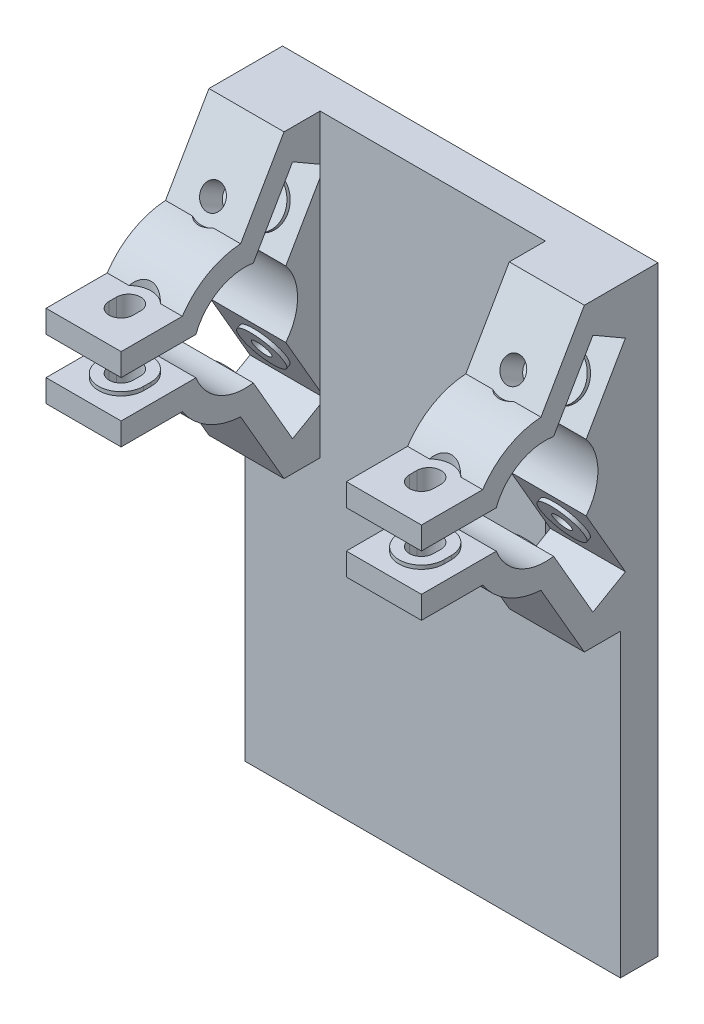
from build123d import *

# Parameters (mm, degrees)
SKETCH_1_W               = 5
SKETCH_1_H               = 80
EXTRUDE_1_DEPTH          = 50
EXTRUDE_2_DEPTH          = 10
SKETCH_6_W               = 10
SKETCH_6_H               = 3.813086718
CUT_EXTRUDE_10_DEPTH     = 1
SKETCH_2_R               = 3
EXTRUDE_3_DEPTH          = 0.5
EXTRUDE_START            = 4.5
SKETCH_2_3_R             = 3
EXTRUDE_4_DEPTH          = 0.5
CUT_EXTRUDE_START        = 0.5
SKETCH_2_4_R             = 1.25
CUT_EXTRUDE_1_DEPTH      = 10
CUT_EXTRUDE_START_2      = 8
SKETCH_2_5_R             = 3
CUT_EXTRUDE_4_DEPTH      = 1
CUT_EXTRUDE_START_3      = 4.5
SKETCH_2_6_R             = 1.6
CUT_EXTRUDE_5_DEPTH      = 3.5
EXTRUDE_START_2          = -3
EXTRUDE_5_DEPTH          = 0.5
EXTRUDE_START_3          = -7.5
EXTRUDE_6_DEPTH          = 0.5
CUT_EXTRUDE_START_4      = 2
CUT_EXTRUDE_6_DEPTH      = 2
CUT_EXTRUDE_7_DEPTH      = 11
CUT_EXTRUDE_8_DEPTH      = 2
MIRROR_6_COPY_1_SKETCH_W = 10
MIRROR_6_COPY_1_SKETCH_H = 3.813086718
MIRROR_6_COPY_1_DEPTH    = 1
MIRROR_6_COPY_2_SKETCH_R = 3
MIRROR_6_COPY_2_DEPTH    = 0.5
MIRROR_START             = 4.5
MIRROR_6_COPY_3_SKETCH_R = 3
MIRROR_6_COPY_3_DEPTH    = 0.5
MIRROR_START_2           = 0.5
MIRROR_6_COPY_4_SKETCH_R = 1.25
MIRROR_6_COPY_4_DEPTH    = 10
MIRROR_START_3           = 8
MIRROR_6_COPY_5_SKETCH_R = 3
MIRROR_6_COPY_5_DEPTH    = 1
MIRROR_6_COPY_6_SKETCH_R = 1.6
MIRROR_6_COPY_6_DEPTH    = 3.5


with BuildPart() as part:
    # Эскиз1 → Бобышка-Вытянуть1 (new body)
    with BuildSketch(Plane(origin=(0, 0, 0), x_dir=(0, 0, -1), z_dir=(1, 0, 0))):
        with Locations((2.5, 0)):
            Rectangle(SKETCH_1_W, SKETCH_1_H)
    extrude(amount=EXTRUDE_1_DEPTH)

    # Эскиз1<3> → Бобышка-Вытянуть2 (add)
    with BuildSketch(Plane(origin=(0, 0, 0), x_dir=(0, 0, -1), z_dir=(1, 0, 0))):
        with BuildLine():
            Line((-4.803847577, 0), (0, 0))
            Line((0, 0), (0, 6.143593539))
            Line((0, 6.143593539), (-3.665063509, 4.027568136))
            Line((-3.665063509, 4.027568136), (-8.895889302, 13.087624174))
            ThreePointArc((-8.895889302, 13.087624174), (-13.5, 13.937822174), (-16.538348415, 17.5))
            Line((-16.538348415, 17.5), (-26.5, 17.5))
            Line((-26.5, 17.5), (-26.5, 14.5))
            Line((-26.5, 14.5), (-18.351646544, 14.5))
            ThreePointArc((-18.351646544, 14.5), (-15, 11.339745962), (-10.587316449, 10.017261929))
            Line((-10.587316449, 10.017261929), (-4.803847577, 0))
        make_face()
        with BuildLine():
            Line((-4.565762283, 15.587624174), (0, 7.679491924))
            Line((0, 7.679491924), (0, 32.320508076))
            Line((0, 32.320508076), (-4.565762283, 24.412375826))
            ThreePointArc((-4.565762283, 24.412375826), (-3, 20), (-4.565762283, 15.587624174))
        make_face()
        with BuildLine():
            Line((0, 33.856406461), (0, 40))
            Line((0, 40), (-4.803847577, 40))
            Line((-4.803847577, 40), (-10.587316449, 29.982738071))
            ThreePointArc((-10.587316449, 29.982738071), (-15, 28.660254038), (-18.351646544, 25.5))
            Line((-18.351646544, 25.5), (-26.5, 25.5))
            Line((-26.5, 25.5), (-26.5, 22.5))
            Line((-26.5, 22.5), (-16.538348415, 22.5))
            ThreePointArc((-16.538348415, 22.5), (-13.5, 26.062177826), (-8.895889302, 26.912375826))
            Line((-8.895889302, 26.912375826), (-3.665063509, 35.972431864))
            Line((-3.665063509, 35.972431864), (0, 33.856406461))
        make_face()
    extrude_2 = extrude(amount=EXTRUDE_2_DEPTH)

    # Эскиз6 → Вырез-Вытянуть10 (cut)
    with BuildSketch(Plane(origin=(0, 8.080127019, 13.995190528), x_dir=(1, 0, 0), z_dir=(0, 0.4999999999999973, 0.8660254037844403))):
        with Locations((5, 27.413964717)):
            Rectangle(SKETCH_6_W, SKETCH_6_H)
    cut_extrude_10 = extrude(amount=CUT_EXTRUDE_10_DEPTH, mode=Mode.SUBTRACT)

    # Эскиз2 → Бобышка-Вытянуть3 (add)
    with BuildSketch(Plane(origin=(0, 8.080127019, 13.995190528), x_dir=(1, 0, 0), z_dir=(0, 0.4999999999999973, 0.8660254037844403))):
        with Locations((5, 23.320508076)):
            Circle(SKETCH_2_R)
    extrude_3 = extrude(amount=EXTRUDE_3_DEPTH)

    # Эскиз2<3> → Бобышка-Вытянуть4 (add)
    with BuildSketch(Plane(origin=(0, 8.080127019, 13.995190528), x_dir=(1, 0, 0), z_dir=(0, 0.4999999999999973, 0.8660254037844403)).offset(EXTRUDE_START)):
        with Locations((5, 23.320508076)):
            Circle(SKETCH_2_3_R)
    extrude_4 = extrude(amount=EXTRUDE_4_DEPTH)

    # Эскиз2<4> → Вырез-Вытянуть1 (cut)
    with BuildSketch(Plane(origin=(0, 8.080127019, 13.995190528), x_dir=(1, 0, 0), z_dir=(0, 0.4999999999999973, 0.8660254037844403)).offset(CUT_EXTRUDE_START)):
        with Locations((5, 23.320508076)):
            Circle(SKETCH_2_4_R)
    cut_extrude_1 = extrude(amount=-CUT_EXTRUDE_1_DEPTH, mode=Mode.SUBTRACT)

    # Эскиз2<5> → Вырез-Вытянуть4 (cut)
    with BuildSketch(Plane(origin=(0, 8.080127019, 13.995190528), x_dir=(1, 0, 0), z_dir=(0, 0.4999999999999973, 0.8660254037844403)).offset(CUT_EXTRUDE_START_2)):
        with Locations((5, 23.320508076)):
            Circle(SKETCH_2_5_R)
    cut_extrude_4 = extrude(amount=CUT_EXTRUDE_4_DEPTH, mode=Mode.SUBTRACT)

    # Эскиз2<6> → Вырез-Вытянуть5 (cut)
    with BuildSketch(Plane(origin=(0, 8.080127019, 13.995190528), x_dir=(1, 0, 0), z_dir=(0, 0.4999999999999973, 0.8660254037844403)).offset(CUT_EXTRUDE_START_3)):
        with Locations((5, 23.320508076)):
            Circle(SKETCH_2_6_R)
    cut_extrude_5 = extrude(amount=CUT_EXTRUDE_5_DEPTH, mode=Mode.SUBTRACT)

    # Зеркальное отражение3: Вырез-Вытянуть10, Бобышка-Вытянуть3, Бобышка-Вытянуть4, Вырез-Вытянуть1, Вырез-Вытянуть4, Вырез-Вытянуть5 across plane
    add(cut_extrude_10.mirror(Plane(origin=(0, 20, 0), x_dir=(0, 0, 1), z_dir=(0, -1, 0))), mode=Mode.SUBTRACT)
    add(extrude_3.mirror(Plane(origin=(0, 20, 0), x_dir=(0, 0, 1), z_dir=(0, -1, 0))))
    add(extrude_4.mirror(Plane(origin=(0, 20, 0), x_dir=(0, 0, 1), z_dir=(0, -1, 0))))
    add(cut_extrude_1.mirror(Plane(origin=(0, 20, 0), x_dir=(0, 0, 1), z_dir=(0, -1, 0))), mode=Mode.SUBTRACT)
    add(cut_extrude_4.mirror(Plane(origin=(0, 20, 0), x_dir=(0, 0, 1), z_dir=(0, -1, 0))), mode=Mode.SUBTRACT)
    add(cut_extrude_5.mirror(Plane(origin=(0, 20, 0), x_dir=(0, 0, 1), z_dir=(0, -1, 0))), mode=Mode.SUBTRACT)

    # Эскиз3 → Бобышка-Вытянуть5 (add)
    with BuildSketch(Plane(origin=(0, 25.5, 0), x_dir=(1, 0, 0), z_dir=(0, 1, 0)).offset(EXTRUDE_START_2)):
        with BuildLine():
            Line((8, -20.5), (8, -21.5))
            ThreePointArc((8, -21.5), (5, -24.5), (2, -21.5))
            Line((2, -21.5), (2, -20.5))
            ThreePointArc((2, -20.5), (5, -17.5), (8, -20.5))
        make_face()
    extrude_5 = extrude(amount=-EXTRUDE_5_DEPTH)

    # Эскиз3<3> → Бобышка-Вытянуть6 (add)
    with BuildSketch(Plane(origin=(0, 25.5, 0), x_dir=(1, 0, 0), z_dir=(0, 1, 0)).offset(EXTRUDE_START_3)):
        with BuildLine():
            Line((8, -20.5), (8, -21.5))
            ThreePointArc((8, -21.5), (5, -24.5), (2, -21.5))
            Line((2, -21.5), (2, -20.5))
            ThreePointArc((2, -20.5), (5, -17.5), (8, -20.5))
        make_face()
    extrude_6 = extrude(amount=-EXTRUDE_6_DEPTH)

    # Эскиз3<4> → Вырез-Вытянуть6 (cut)
    with BuildSketch(Plane(origin=(0, 25.5, 0), x_dir=(1, 0, 0), z_dir=(0, 1, 0)).offset(CUT_EXTRUDE_START_4)):
        with BuildLine():
            Line((8, -20.5), (8, -21.5))
            ThreePointArc((8, -21.5), (5, -24.5), (2, -21.5))
            Line((2, -21.5), (2, -20.5))
            ThreePointArc((2, -20.5), (5, -17.5), (8, -20.5))
        make_face()
        with BuildLine():
            Line((6.6, -20.5), (6.6, -21.5))
            ThreePointArc((6.6, -21.5), (5, -23.1), (3.4, -21.5))
            Line((3.4, -21.5), (3.4, -20.5))
            ThreePointArc((3.4, -20.5), (5, -18.9), (6.6, -20.5))
        make_face(mode=Mode.SUBTRACT)
    cut_extrude_6 = extrude(amount=-CUT_EXTRUDE_6_DEPTH, mode=Mode.SUBTRACT)

    # Эскиз3<6> → Вырез-Вытянуть7 (cut)
    with BuildSketch(Plane(origin=(0, 25.5, 0), x_dir=(1, 0, 0), z_dir=(0, 1, 0))):
        with BuildLine():
            Line((6.6, -20.5), (6.6, -21.5))
            ThreePointArc((6.6, -21.5), (5, -23.1), (3.4, -21.5))
            Line((3.4, -21.5), (3.4, -20.5))
            ThreePointArc((3.4, -20.5), (5, -18.9), (6.6, -20.5))
        make_face()
    cut_extrude_7 = extrude(amount=-CUT_EXTRUDE_7_DEPTH, mode=Mode.SUBTRACT)

    # Эскиз4 → Вырез-Вытянуть8 (cut)
    with BuildSketch(Plane.XZ.offset(-14.5)):
        Polygon((5, 17.266838493), (7.8, 18.883419246), (7.8, 22.116580754), (5, 23.733161507), (2.2, 22.116580754), (2.2, 18.883419246), align=None)
    cut_extrude_8 = extrude(amount=CUT_EXTRUDE_8_DEPTH, mode=Mode.SUBTRACT)

    # Зеркальное отражение6: Бобышка-Вытянуть2, Вырез-Вытянуть10, Бобышка-Вытянуть3, Бобышка-Вытянуть4, Вырез-Вытянуть1, Вырез-Вытянуть4, Вырез-Вытянуть5, Бобышка-Вытянуть5, Бобышка-Вытянуть6, Вырез-Вытянуть6, Вырез-Вытянуть7, Вырез-Вытянуть8 across plane
    add(extrude_2.mirror(Plane(origin=(25, 0, 0), x_dir=(0, 0, 1), z_dir=(1, 0, 0))))
    add(cut_extrude_10.mirror(Plane(origin=(25, 0, 0), x_dir=(0, 0, 1), z_dir=(1, 0, 0))), mode=Mode.SUBTRACT)
    add(extrude_3.mirror(Plane(origin=(25, 0, 0), x_dir=(0, 0, 1), z_dir=(1, 0, 0))))
    add(extrude_4.mirror(Plane(origin=(25, 0, 0), x_dir=(0, 0, 1), z_dir=(1, 0, 0))))
    add(cut_extrude_1.mirror(Plane(origin=(25, 0, 0), x_dir=(0, 0, 1), z_dir=(1, 0, 0))), mode=Mode.SUBTRACT)
    add(cut_extrude_4.mirror(Plane(origin=(25, 0, 0), x_dir=(0, 0, 1), z_dir=(1, 0, 0))), mode=Mode.SUBTRACT)
    add(cut_extrude_5.mirror(Plane(origin=(25, 0, 0), x_dir=(0, 0, 1), z_dir=(1, 0, 0))), mode=Mode.SUBTRACT)
    add(extrude_5.mirror(Plane(origin=(25, 0, 0), x_dir=(0, 0, 1), z_dir=(1, 0, 0))))
    add(extrude_6.mirror(Plane(origin=(25, 0, 0), x_dir=(0, 0, 1), z_dir=(1, 0, 0))))
    add(cut_extrude_6.mirror(Plane(origin=(25, 0, 0), x_dir=(0, 0, 1), z_dir=(1, 0, 0))), mode=Mode.SUBTRACT)
    add(cut_extrude_7.mirror(Plane(origin=(25, 0, 0), x_dir=(0, 0, 1), z_dir=(1, 0, 0))), mode=Mode.SUBTRACT)
    add(cut_extrude_8.mirror(Plane(origin=(25, 0, 0), x_dir=(0, 0, 1), z_dir=(1, 0, 0))), mode=Mode.SUBTRACT)

    # Зеркальное отражение6 copy 1 sketch → Зеркальное отражение6 copy 1 (cut)
    with BuildSketch(Plane(origin=(50, 31.919872981, 13.995190528), x_dir=(-1, 0, 0), z_dir=(0, -0.4999999999999973, 0.8660254037844403))):
        with Locations((5, 27.413964717)):
            Rectangle(MIRROR_6_COPY_1_SKETCH_W, MIRROR_6_COPY_1_SKETCH_H)
    extrude(amount=MIRROR_6_COPY_1_DEPTH, mode=Mode.SUBTRACT)

    # Зеркальное отражение6 copy 2 sketch → Зеркальное отражение6 copy 2 (add)
    with BuildSketch(Plane(origin=(50, 31.919872981, 13.995190528), x_dir=(-1, 0, 0), z_dir=(0, -0.4999999999999973, 0.8660254037844403))):
        with Locations((5, 23.320508076)):
            Circle(MIRROR_6_COPY_2_SKETCH_R)
    extrude(amount=MIRROR_6_COPY_2_DEPTH)

    # Зеркальное отражение6 copy 3 sketch → Зеркальное отражение6 copy 3 (add)
    with BuildSketch(Plane(origin=(50, 31.919872981, 13.995190528), x_dir=(-1, 0, 0), z_dir=(0, -0.4999999999999973, 0.8660254037844403)).offset(MIRROR_START)):
        with Locations((5, 23.320508076)):
            Circle(MIRROR_6_COPY_3_SKETCH_R)
    extrude(amount=MIRROR_6_COPY_3_DEPTH)

    # Зеркальное отражение6 copy 4 sketch → Зеркальное отражение6 copy 4 (cut)
    with BuildSketch(Plane(origin=(50, 31.919872981, 13.995190528), x_dir=(-1, 0, 0), z_dir=(0, -0.4999999999999973, 0.8660254037844403)).offset(MIRROR_START_2)):
        with Locations((5, 23.320508076)):
            Circle(MIRROR_6_COPY_4_SKETCH_R)
    extrude(amount=-MIRROR_6_COPY_4_DEPTH, mode=Mode.SUBTRACT)

    # Зеркальное отражение6 copy 5 sketch → Зеркальное отражение6 copy 5 (cut)
    with BuildSketch(Plane(origin=(50, 31.919872981, 13.995190528), x_dir=(-1, 0, 0), z_dir=(0, -0.4999999999999973, 0.8660254037844403)).offset(MIRROR_START_3)):
        with Locations((5, 23.320508076)):
            Circle(MIRROR_6_COPY_5_SKETCH_R)
    extrude(amount=MIRROR_6_COPY_5_DEPTH, mode=Mode.SUBTRACT)

    # Зеркальное отражение6 copy 6 sketch → Зеркальное отражение6 copy 6 (cut)
    with BuildSketch(Plane(origin=(50, 31.919872981, 13.995190528), x_dir=(-1, 0, 0), z_dir=(0, -0.4999999999999973, 0.8660254037844403)).offset(MIRROR_START)):
        with Locations((5, 23.320508076)):
            Circle(MIRROR_6_COPY_6_SKETCH_R)
    extrude(amount=MIRROR_6_COPY_6_DEPTH, mode=Mode.SUBTRACT)


solid = part.part
